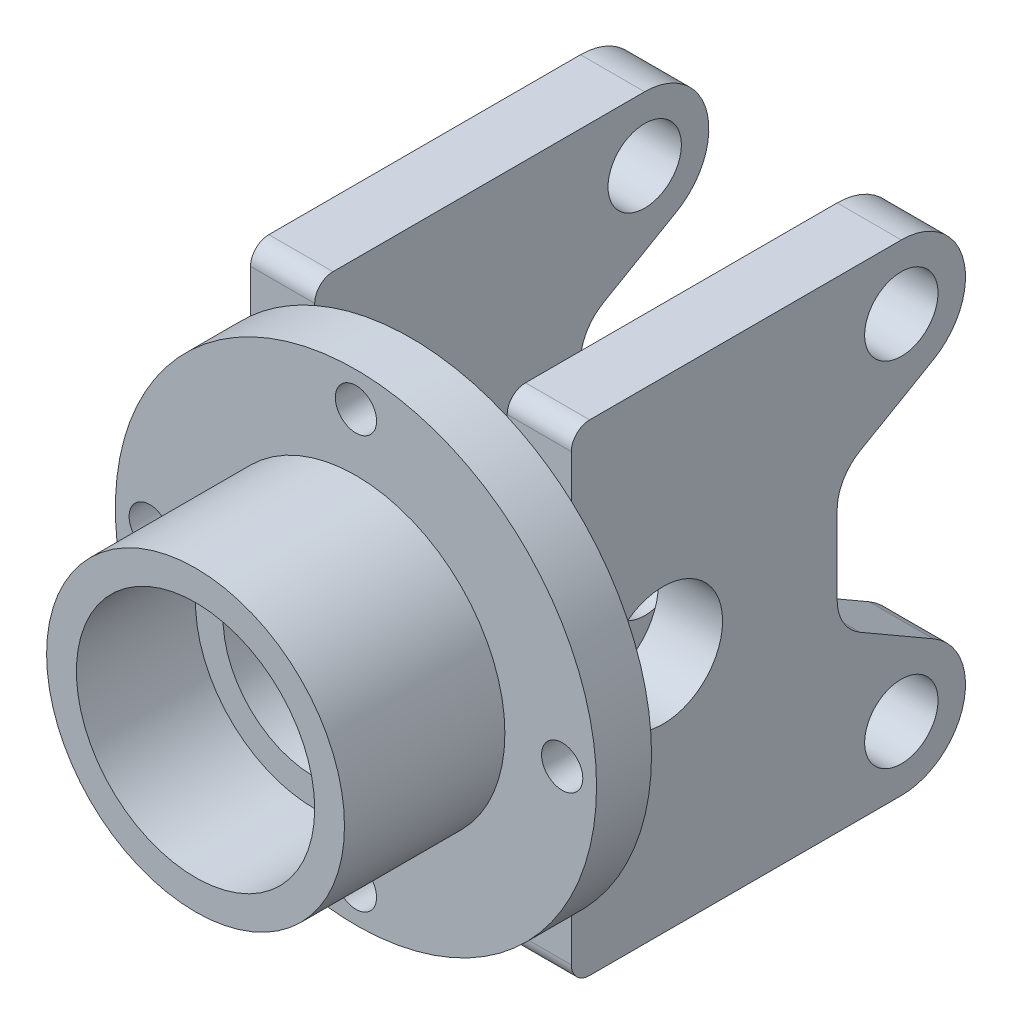
from build123d import *

# Parameters (mm, degrees)
SKETCH_1_R               = 52.5
EXTRUDE_1_DEPTH          = 12
SKETCH_2_R               = 32.5
EXTRUDE_2_DEPTH          = 35
SKETCH_3_R               = 26
CUT_EXTRUDE_1_DEPTH      = 26
SKETCH_4_R               = 20
CUT_EXTRUDE_2_DEPTH      = 21
SKETCH_5_R               = 8
SKETCH_5_R_2             = 13
EXTRUDE_3_DEPTH          = 35
SKETCH_6_W               = 42
SKETCH_6_H               = 101.243911614
CUT_EXTRUDE_3_DEPTH      = 153.922365925
SKETCH_7_R               = 4.5
CUT_EXTRUDE_4_DEPTH      = 114.615579918
PATTERN_CIRCULAR_1_COUNT = 4


with BuildPart() as part:
    # 草图1 → 凸台-拉伸1 (new body)
    with BuildSketch(Plane.XY):
        Circle(SKETCH_1_R)
    extrude(amount=-EXTRUDE_1_DEPTH)

    # 草图2 → 凸台-拉伸2 (add)
    with BuildSketch(Plane.XY):
        Circle(SKETCH_2_R)
    extrude(amount=EXTRUDE_2_DEPTH)

    # 草图3 → 切除-拉伸1 (cut)
    with BuildSketch(Plane.XY.offset(35)):
        Circle(SKETCH_3_R)
    extrude(amount=-CUT_EXTRUDE_1_DEPTH, mode=Mode.SUBTRACT)

    # 草图4 → 切除-拉伸2 (cut)
    with BuildSketch(Plane.XY.offset(9)):
        Circle(SKETCH_4_R)
    extrude(amount=-CUT_EXTRUDE_2_DEPTH, mode=Mode.SUBTRACT)

    # 草图5 → 凸台-拉伸3 (add, symmetric)
    with BuildSketch(Plane(origin=(0, 0, 0), x_dir=(0, 0, -1), z_dir=(1, 0, 0))):
        with BuildLine():
            Line((84, -52.5), (16, -52.5))
            ThreePointArc((16, -52.5), (13.171572875, -51.328427125), (12, -48.5))
            Line((12, -48.5), (12, 48.5))
            ThreePointArc((12, 48.5), (13.171572875, 51.328427125), (16, 52.5))
            Line((16, 52.5), (84, 52.5))
            ThreePointArc((84, 52.5), (97.522961568, 42.123466631), (91, 26.375644347))
            Line((91, 26.375644347), (75, 17.13804004))
            ThreePointArc((75, 17.13804004), (71.339745962, 13.477786002), (70, 8.477786002))
            Line((70, 8.477786002), (70, -8.477786002))
            ThreePointArc((70, -8.477786002), (71.339745962, -13.477786002), (75, -17.13804004))
            Line((75, -17.13804004), (91, -26.375644347))
            ThreePointArc((91, -26.375644347), (97.522961568, -42.123466631), (84, -52.5))
        make_face()
        with Locations((84, 38.5)):
            Circle(SKETCH_5_R, mode=Mode.SUBTRACT)
        with Locations((84, -38.5)):
            Circle(SKETCH_5_R, mode=Mode.SUBTRACT)
        with Locations((32, 0)):
            Circle(SKETCH_5_R_2, mode=Mode.SUBTRACT)
    extrude(amount=EXTRUDE_3_DEPTH, both=True)

    # 草图6 → 切除-拉伸3 (cut, through all)
    with BuildSketch(Plane.XZ.offset(52.5)):
        with Locations((0, -62.621955807)):
            Rectangle(SKETCH_6_W, SKETCH_6_H)
    extrude(amount=-CUT_EXTRUDE_3_DEPTH, mode=Mode.SUBTRACT)

    # 草图7 → 切除-拉伸4 (cut, through all)
    with BuildSketch(Plane(origin=(0, 0, -12), x_dir=(-1, 0, 0), z_dir=(0, 0, -1))):
        with Locations((-45, 0)):
            Circle(SKETCH_7_R)
    cut_extrude_4 = extrude(amount=-CUT_EXTRUDE_4_DEPTH, mode=Mode.SUBTRACT)

    # 阵列(圆周)1: 切除-拉伸4 ×4 about axis
    pattern_circular_1_axis = Axis((0, 0, 0), (0, 0, 1))
    for i in range(1, PATTERN_CIRCULAR_1_COUNT):
        add(cut_extrude_4.rotate(pattern_circular_1_axis, i * 360 / PATTERN_CIRCULAR_1_COUNT), mode=Mode.SUBTRACT)


solid = part.part
